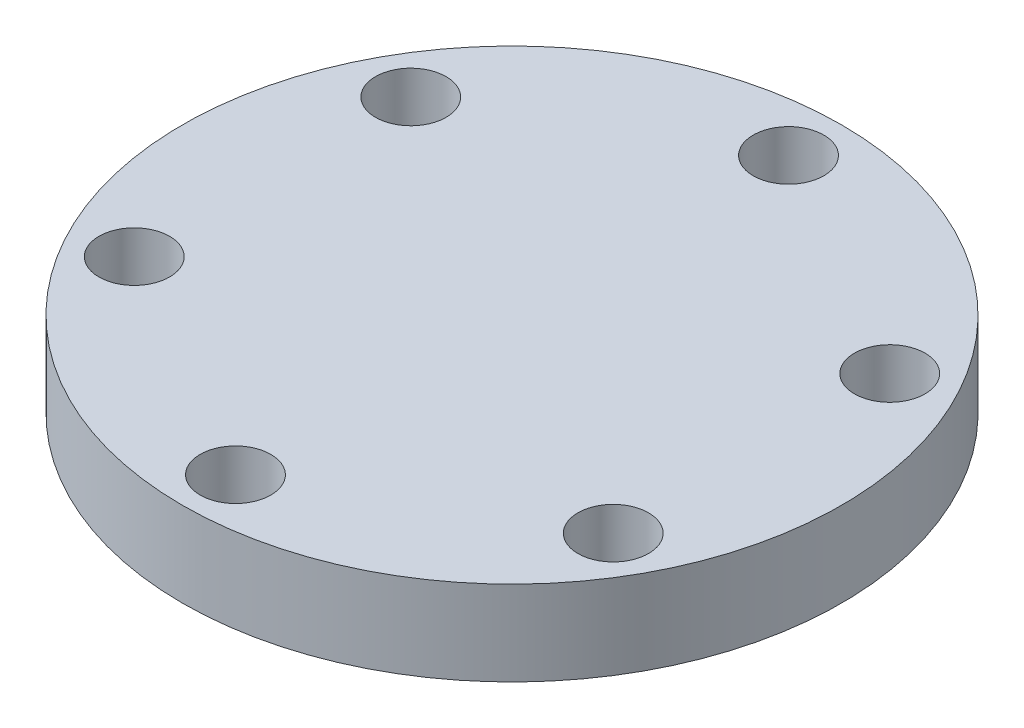
from build123d import *

# Parameters (mm, degrees)
SKETCH1_R           = 7
BOSS_EXTRUDE1_DEPTH = 1.8
SKETCH2_R           = 0.75
CUT_EXTRUDE1_DEPTH  = 11.061808982
CIRPATTERN1_COUNT   = 6


with BuildPart() as part:
    # Sketch1 → Boss-Extrude1 (new body)
    with BuildSketch(Plane(origin=(0, 0, 0), x_dir=(1, 0, 0), z_dir=(0, 1, 0))):
        with Locations(Location((0, 0, 0), (0, 0, 270))):
            Circle(SKETCH1_R)
    extrude(amount=BOSS_EXTRUDE1_DEPTH)

    # Sketch2 → Cut-Extrude1 (cut, through all)
    with BuildSketch(Plane.XZ):
        with Locations(Location((0, 5.873718021, 0), (0, 0, 270))):
            Circle(SKETCH2_R)
    cut_extrude1 = extrude(amount=-CUT_EXTRUDE1_DEPTH, mode=Mode.SUBTRACT)

    # CirPattern1: Cut-Extrude1 ×6 about axis
    cirpattern1_axis = Axis((0, 0, 0), (0, 1, 0))
    for i in range(1, CIRPATTERN1_COUNT):
        add(cut_extrude1.rotate(cirpattern1_axis, i * 360 / CIRPATTERN1_COUNT), mode=Mode.SUBTRACT)


solid = part.part
